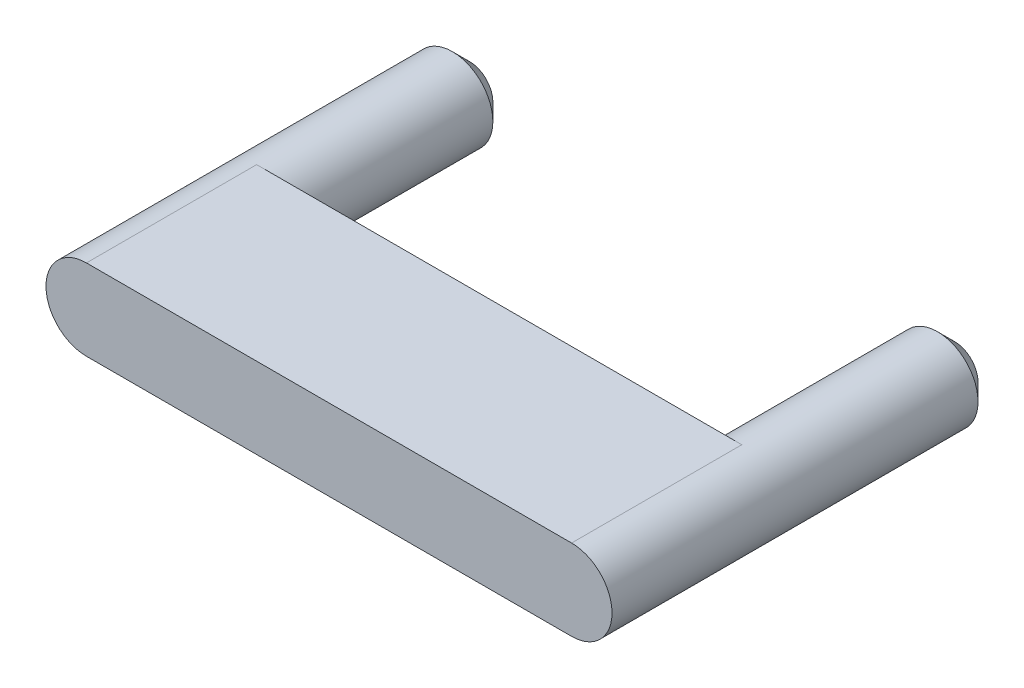
from build123d import *

# Parameters (mm, degrees)
BOSS_EXTRUDE1_DEPTH = 4
BOSS_EXTRUDE2_START = -5
SKETCH1_4_R         = 0.95
BOSS_EXTRUDE2_DEPTH = 5
CHAMFER1_SIZE       = 0.4


with BuildPart() as part:
    # Sketch1 → Boss-Extrude1 (new body)
    with BuildSketch(Plane.XY):
        with BuildLine():
            Line((11.4, 0.95), (0, 0.95))
            ThreePointArc((0, 0.95), (-0.95, 0), (0, -0.95))
            Line((0, -0.95), (11.4, -0.95))
            ThreePointArc((11.4, -0.95), (12.35, 0), (11.4, 0.95))
        make_face()
    extrude(amount=BOSS_EXTRUDE1_DEPTH)

    # Sketch1<4> → Boss-Extrude2 (add)
    with BuildSketch(Plane.XY.offset(BOSS_EXTRUDE2_START)):
        with Locations(Location((0, 0, 0), (0, 0, 90))):
            Circle(SKETCH1_4_R)
        with Locations(Location((11.4, 0, 0), (0, 0, 270))):
            Circle(SKETCH1_4_R)
    extrude(amount=BOSS_EXTRUDE2_DEPTH)

    # Chamfer1
    chamfer1_edges = [part.edges().sort_by_distance(p)[0] for p in [
        (0, -0.95, -5),
        (11.4, 0.95, -5),
    ]]
    chamfer(chamfer1_edges, length=CHAMFER1_SIZE)


solid = part.part
